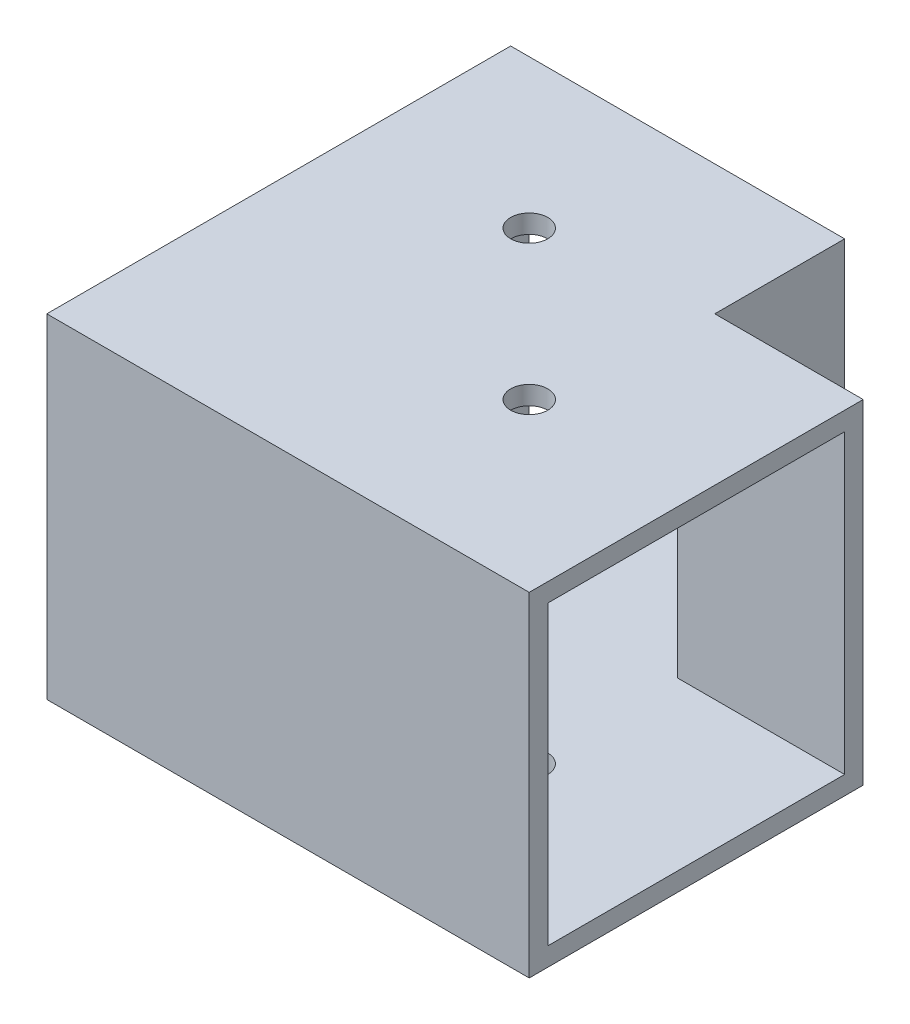
from build123d import *

# Parameters (mm, degrees)
SKETCH1_W           = 114.3
SKETCH1_H           = 114.3
SKETCH1_W_2         = 101.6
SKETCH1_H_2         = 101.6
EXTRUDE_THIN1_DEPTH = 50.8
SKETCH3_W           = 114.3
SKETCH3_H           = 114.3
SKETCH3_W_2         = 101.6
SKETCH3_H_2         = 101.6
EXTRUDE_THIN2_DEPTH = 50.8
BOSS_EXTRUDE1_DEPTH = 114.3
BOSS_EXTRUDE2_REACH = 165.011
SKETCH5_W           = 6.35
SKETCH5_H           = 101.6
SKETCH6_R           = 6.35
CUT_EXTRUDE1_DEPTH  = 224.426173489


with BuildPart() as part:
    # Sketch1 → Extrude-Thin1 (new body)
    with BuildSketch(Plane.XY):
        Rectangle(SKETCH1_W, SKETCH1_H)
        Rectangle(SKETCH1_W_2, SKETCH1_H_2, mode=Mode.SUBTRACT)
    extrude(amount=EXTRUDE_THIN1_DEPTH)

    # Sketch3 → Extrude-Thin2 (add)
    with BuildSketch(Plane(origin=(57.15, 0, 0), x_dir=(0, 0, -1), z_dir=(1, 0, 0))):
        with Locations((-101.6, 0)):
            Rectangle(SKETCH3_W, SKETCH3_H)
        with Locations((-101.6, 0)):
            Rectangle(SKETCH3_W_2, SKETCH3_H_2, mode=Mode.SUBTRACT)
    extrude(amount=EXTRUDE_THIN2_DEPTH)

    # Sketch4 → Boss-Extrude1 (add)
    with BuildSketch(Plane.ZY.offset(-57.15)):
        Polygon((50.8, -50.8), (50.8, -57.15), (158.75, -57.15), (158.75, 57.15), (50.8, 57.15), (50.8, 50.8), (152.4, 50.8), (152.4, -50.8), align=None)
    extrude(amount=BOSS_EXTRUDE1_DEPTH)

    # Sketch5 → Boss-Extrude2 (add, up to next)
    with BuildSketch(Plane.XY.offset(50.8), mode=Mode.PRIVATE) as boss_extrude2_sk1:
        with Locations((-53.975, 0)):
            Rectangle(SKETCH5_W, SKETCH5_H)
    boss_extrude2_tool1 = extrude(boss_extrude2_sk1.sketch, amount=BOSS_EXTRUDE2_REACH, mode=Mode.PRIVATE) - part.part
    add(boss_extrude2_tool1.solids().sort_by_distance((-53.975, 0, 50.8))[0])

    # Sketch6 → Cut-Extrude1 (cut, through all)
    with BuildSketch(Plane(origin=(0, 57.15, 0), x_dir=(1, 0, 0), z_dir=(0, 1, 0))):
        with Locations(Location((0, -50.8, 0), (0, 0, 270))):
            Circle(SKETCH6_R)
    cut_extrude1 = extrude(amount=-CUT_EXTRUDE1_DEPTH, mode=Mode.SUBTRACT)

    # Mirror1: Cut-Extrude1 across plane
    add(cut_extrude1.mirror(Plane(origin=(50.8, 0, 50.8), x_dir=(-0.7071067811865477, 0, 0.7071067811865474), z_dir=(0.7071067811865476, 0, 0.7071067811865476))), mode=Mode.SUBTRACT)


solid = part.part
